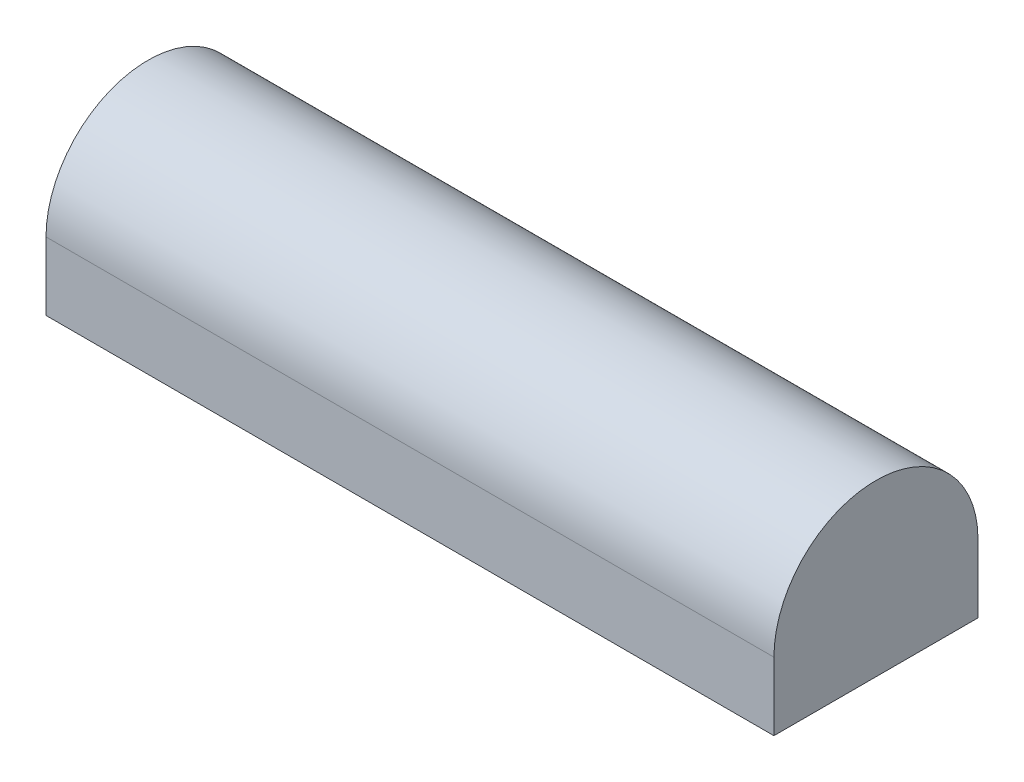
from build123d import *

# Parameters (mm, degrees)
SKETCH1_W           = 3
SKETCH1_H           = 1
BOSS_EXTRUDE1_DEPTH = 10.7


with BuildPart() as part:
    # Sketch1 → Boss-Extrude1 (new body)
    with BuildSketch(Plane(origin=(0, 0, 0), x_dir=(0, 0, -1), z_dir=(1, 0, 0))):
        with BuildLine():
            ThreePointArc((-1.5, 0), (0, 1.5), (1.5, 0))
            Line((1.5, 0), (-1.5, 0))
        make_face()
        with Locations((0, -0.5)):
            Rectangle(SKETCH1_W, SKETCH1_H)
    extrude(amount=BOSS_EXTRUDE1_DEPTH)


solid = part.part
